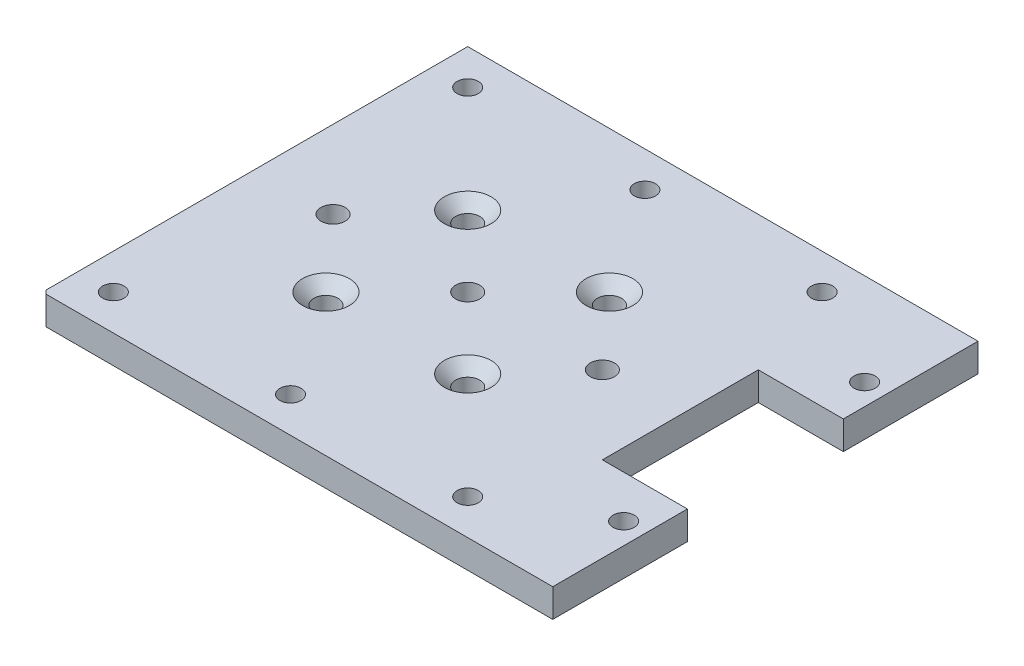
from build123d import *

# Parameters (mm, degrees)
SKETCH_1_W                   = 60
SKETCH_1_H                   = 60
EXTRUDE_1_DEPTH              = 4
HOLE_WIZARD_M3_1_D           = 3.4
HOLE_WIZARD_M3_1_CSINK_D     = 6.6
HOLE_WIZARD_M3_1_CSINK_ANGLE = 90
HOLE_WIZARD_M3_2_D           = 3.4
HOLE_WIZARD_M3_2_CSINK_D     = 6.6
HOLE_WIZARD_M3_2_CSINK_ANGLE = 90
HOLE_WIZARD_1_D              = 3
SKETCH_9_W                   = 12
SKETCH_9_H                   = 19
SKETCH_9_R                   = 1.5
EXTRUDE_3_DEPTH              = 4
CHAMFER_1_SIZE               = 0.5


with BuildPart() as part:
    # 草图1 → 凸台-拉伸1 (new body)
    with BuildSketch(Plane(origin=(0, 0, 0), x_dir=(1, 0, 0), z_dir=(0, 1, 0))):
        Rectangle(SKETCH_1_W, SKETCH_1_H)
    extrude(amount=EXTRUDE_1_DEPTH)

    # M3 十字槽沉头木螺钉的锥形沉头孔1 (through all)
    with Locations(Plane(origin=(0, 4, 0), x_dir=(1, 0, 0), z_dir=(0, 1, 0))):
        with Locations((-10, 10), (10, 10), (10, -10), (-10, -10)):
            CounterSinkHole(HOLE_WIZARD_M3_1_D / 2, HOLE_WIZARD_M3_1_CSINK_D / 2, counter_sink_angle=HOLE_WIZARD_M3_1_CSINK_ANGLE)

    # M3 十字槽沉头木螺钉的锥形沉头孔2 (through all)
    with Locations(Plane(origin=(0, 0, 0), x_dir=(-1, 0, 0), z_dir=(0, -1, 0))):
        with Locations((19, 0), (0, 0), (-19, 0)):
            CounterSinkHole(HOLE_WIZARD_M3_2_D / 2, HOLE_WIZARD_M3_2_CSINK_D / 2, counter_sink_angle=HOLE_WIZARD_M3_2_CSINK_ANGLE)

    # 孔1 (through all)
    with Locations(Plane(origin=(0, 4, 0), x_dir=(1, 0, 0), z_dir=(0, 1, 0))):
        with Locations((25, 25), (25, -25), (0, -25), (-25, -25), (-25, 25), (0, 25)):
            Hole(HOLE_WIZARD_1_D / 2)

    # 草图9 → 凸台-拉伸3 (add)
    with BuildSketch(Plane(origin=(0, 4, 0), x_dir=(1, 0, 0), z_dir=(0, 1, 0))):
        with Locations((36, -20.5)):
            Rectangle(SKETCH_9_W, SKETCH_9_H)
        with Locations(Location((39, -17, 0), (0, 0, 270))):
            Circle(SKETCH_9_R, mode=Mode.SUBTRACT)
    extrude_3 = extrude(amount=-EXTRUDE_3_DEPTH)

    # 倒角1
    chamfer_1_edges = [part.edges().sort_by_distance(p)[0] for p in [
        (-30, 2, 30),
    ]]
    chamfer(chamfer_1_edges, length=CHAMFER_1_SIZE)

    # 镜向1: 凸台-拉伸3 across plane
    add(extrude_3.mirror(Plane.XY))


solid = part.part
